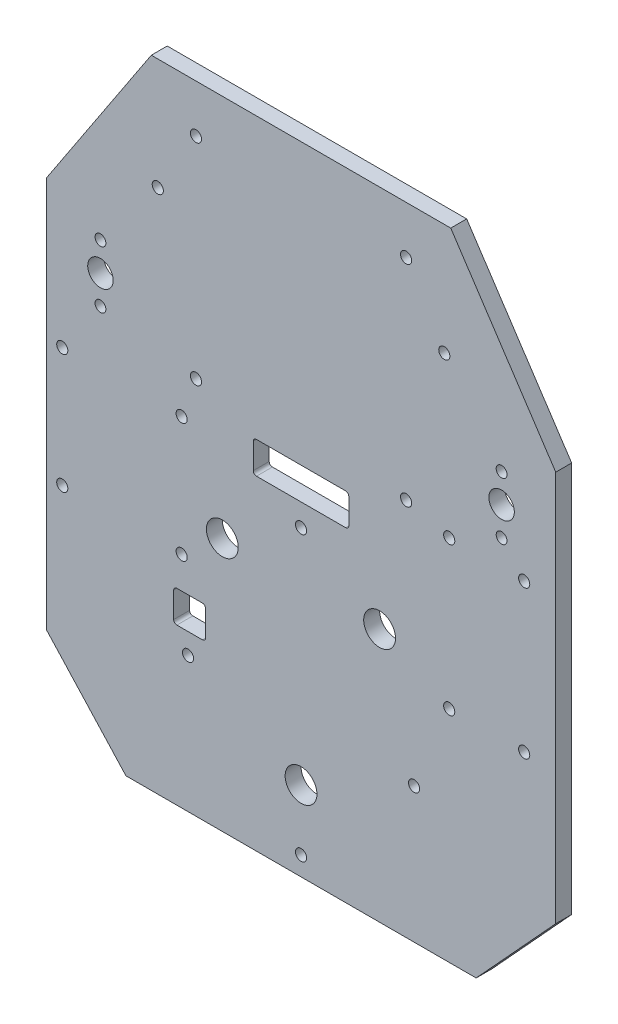
from build123d import *

# Parameters (mm, degrees)
ESQUISSE1_W                                = 200
ESQUISSE1_H                                = 160
ESQUISSE1_R                                = 5
ESQUISSE1_R_2                              = 1.75
ESQUISSE1_W_2                              = 10
ESQUISSE1_H_2                              = 10
ESQUISSE1_H_3                              = 30
BOSS_EXTRU_1_DEPTH                         = 5
CONG_2_R                                   = 1
ENL_V_MAT_EXTRU_1_DEPTH                    = 129.16005618
ESQUISSE3_R                                = 1.75
TROU_CUVE_DIRECTION_DEPTH                  = 129.16005618
ESQUISSE4_R                                = 1.7
ESQUISSE4_R_2                              = 4
ESQUISSE4_R_3                              = 5
POINTE_AVANT_TROUS_BERCEAU_ET_CABLES_DEPTH = 129.16005618


with BuildPart() as part:
    # Esquisse1 → Boss.-Extru.1 (new body)
    with BuildSketch(Plane(origin=(0, 0, 0), x_dir=(0, 1, 0), z_dir=(0, 0, 1))):
        Rectangle(ESQUISSE1_W, ESQUISSE1_H)
        with Locations(Location((-75, 0, 0), (0, 0, 270))):
            Circle(ESQUISSE1_R, mode=Mode.SUBTRACT)
        with Locations(Location((-57.5, 35.5, 0), (0, 0, 270))):
            Circle(ESQUISSE1_R_2, mode=Mode.SUBTRACT)
        with Locations(Location((-57.5, -35.5, 0), (0, 0, 90))):
            Circle(ESQUISSE1_R_2, mode=Mode.SUBTRACT)
        with Locations(Location((65, 45, 0), (0, 0, 270))):
            Circle(ESQUISSE1_R_2, mode=Mode.SUBTRACT)
        with Locations(Location((65, -45, 0), (0, 0, 90))):
            Circle(ESQUISSE1_R_2, mode=Mode.SUBTRACT)
        with Locations(Location((-31, 37.5, 0), (0, 0, 270))):
            Circle(ESQUISSE1_R_2, mode=Mode.SUBTRACT)
        with Locations(Location((-31, 75, 0), (0, 0, 270))):
            Circle(ESQUISSE1_R_2, mode=Mode.SUBTRACT)
        with Locations(Location((6.5, 75, 0), (0, 0, 270))):
            Circle(ESQUISSE1_R_2, mode=Mode.SUBTRACT)
        with Locations(Location((6.5, 37.5, 0), (0, 0, 270))):
            Circle(ESQUISSE1_R_2, mode=Mode.SUBTRACT)
        with Locations(Location((-31, -46.541307377, 0), (0, 0, 270))):
            Circle(ESQUISSE1_R_2, mode=Mode.SUBTRACT)
        with Locations(Location((-31, -70.091307377, 0), (0, 0, 270))):
            Circle(ESQUISSE1_R_2, mode=Mode.SUBTRACT)
        with Locations(Location((15.5, -46.541307377, 0), (0, 0, 270))):
            Circle(ESQUISSE1_R_2, mode=Mode.SUBTRACT)
        with Locations(Location((15.5, -70.091307377, 0), (0, 0, 270))):
            Circle(ESQUISSE1_R_2, mode=Mode.SUBTRACT)
        with Locations(Location((-4.999283545, 0, 0), (0, 0, 270))):
            Circle(ESQUISSE1_R_2, mode=Mode.SUBTRACT)
        with Locations(Location((85, 33, 0), (0, 0, 270))):
            Circle(ESQUISSE1_R_2, mode=Mode.SUBTRACT)
        with Locations(Location((85.001189598, -32.999999989, 0), (0, 0, 270))):
            Circle(ESQUISSE1_R_2, mode=Mode.SUBTRACT)
        with Locations(Location((19, 33, 0), (0, 0, 270))):
            Circle(ESQUISSE1_R_2, mode=Mode.SUBTRACT)
        with Locations(Location((19.001189598, -32.999999989, 0), (0, 0, 270))):
            Circle(ESQUISSE1_R_2, mode=Mode.SUBTRACT)
        with Locations((-46, 35)):
            Rectangle(ESQUISSE1_W_2, ESQUISSE1_H_2, mode=Mode.SUBTRACT)
        with Locations((7, 0)):
            Rectangle(ESQUISSE1_W_2, ESQUISSE1_H_3, mode=Mode.SUBTRACT)
    extrude(amount=BOSS_EXTRU_1_DEPTH)

    # Congé2
    cong_2_edges = [part.edges().sort_by_distance(p)[0] for p in [
        (-40, -51, 2.5),
        (-30, -51, 2.5),
        (-30, -41, 2.5),
        (-40, -41, 2.5),
        (-15, 2, 2.5),
        (15, 2, 2.5),
        (15, 12, 2.5),
        (-15, 12, 2.5),
    ]]
    fillet(cong_2_edges, radius=CONG_2_R)

    # Esquisse2 → Enlèv. mat.-Extru.1 (cut, through all)
    with BuildSketch(Plane.XY.offset(5)):
        Polygon((-573.580399643, 598.167108478), (-698.698151963, -488.082468479), (684.299979338, -647.380682556), (762.904681953, 702.431902078), align=None)
        Polygon((-110, 40), (0, 160), (110, 40), (110, -40), (0, -160), (-110, -40), align=None, mode=Mode.SUBTRACT)
    extrude(amount=-ENL_V_MAT_EXTRU_1_DEPTH, mode=Mode.SUBTRACT)

    # Esquisse3 → Trou cuve direction (cut, through all)
    with BuildSketch(Plane(origin=(0, 0, 0), x_dir=(0, 1, 0), z_dir=(0, 0, 1))):
        with Locations(Location((-94.001515359, 0.004041019, 0), (0, 0, 270))):
            Circle(ESQUISSE3_R)
    extrude(amount=TROU_CUVE_DIRECTION_DEPTH, mode=Mode.SUBTRACT)

    # Esquisse4 → Pointe avant, trous berceau et cables (cut, through all)
    with BuildSketch(Plane.XY.offset(5)):
        with Locations((-63.004041019, 23.738484641)):
            Circle(ESQUISSE4_R)
        with Locations((-63.004041019, 41.738484641)):
            Circle(ESQUISSE4_R)
        with Locations((62.995958981, 23.738484641)):
            Circle(ESQUISSE4_R)
        with Locations((62.995958981, 41.738484641)):
            Circle(ESQUISSE4_R)
        with Locations((-63.004041019, 32.738484641)):
            Circle(ESQUISSE4_R_2)
        with Locations((62.995958981, 32.738484641)):
            Circle(ESQUISSE4_R_2)
        with Locations((-24.724041019, -20.261515359)):
            Circle(ESQUISSE4_R_3)
        with Locations((24.675958981, -20.261515359)):
            Circle(ESQUISSE4_R_3)
        Polygon((-82.024041019, 47.038484641), (-45.024041019, 103.038484641), (-83.024041019, 103.038484641), (-83.024041019, 47.038484641), align=None)
        Polygon((82.015958981, 47.038484641), (45.015958981, 103.038484641), (83.015958981, 103.038484641), (83.015958981, 47.038484641), align=None)
    extrude(amount=-POINTE_AVANT_TROUS_BERCEAU_ET_CABLES_DEPTH, mode=Mode.SUBTRACT)


solid = part.part
